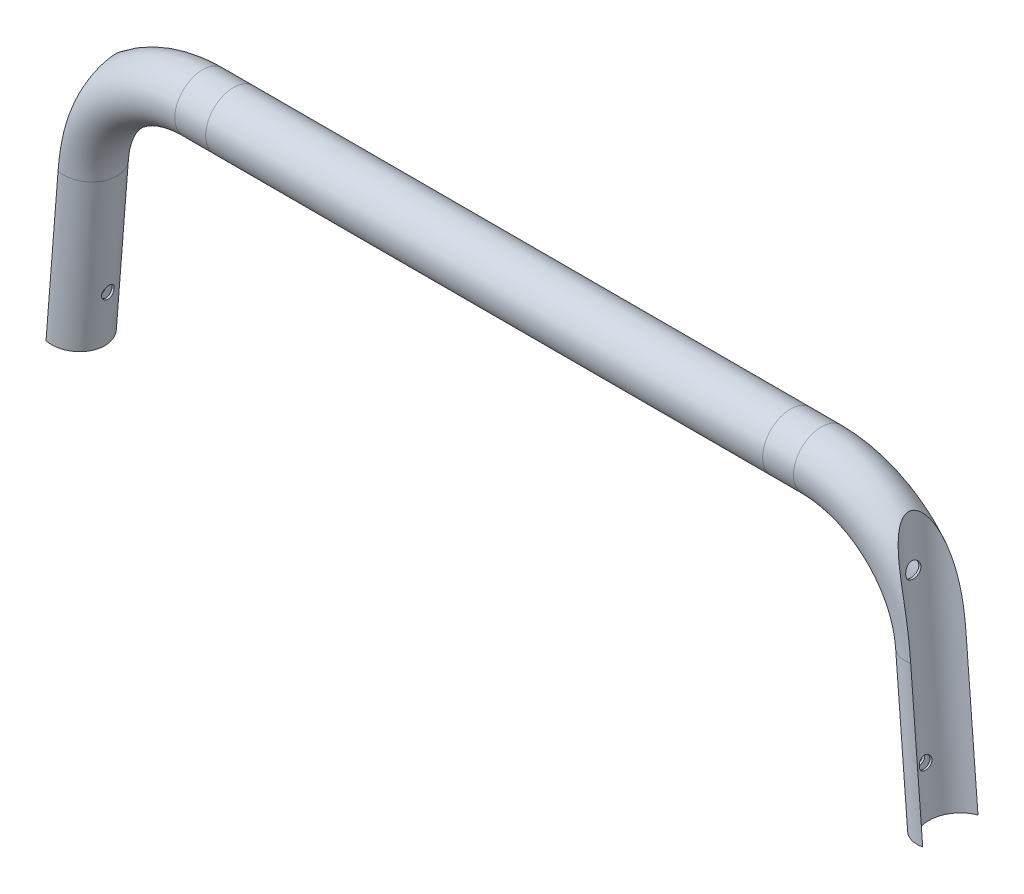
from build123d import *

# Parameters (mm, degrees)
SKETCH2_R               = 11
SKETCH2_R_2             = 10.2
SKETCH3_R               = 11.23581799789534
CUT_EXTRUDE1_DEPTH      = 230.5845222963601
BOSS_EXTRUDE1_REACH     = 223.606
CUT_EXTRUDE2_REACH      = 365.113
CUT_EXTRUDE2_END_RADIUS = 11.00000000000001
SKETCH8_R               = 2.5
CUT_EXTRUDE3_REACH      = 369.953
CUT_EXTRUDE3_END_RADIUS = 12.035817997895382
SKETCH9_R               = 3.0000000000000013


with BuildPart() as part:
    # Sweep1: sweep along a path in Sketch1
    with BuildLine(Plane.XY) as sweep1_path:
        Line((-171.8, -101.9), (-167.04400396794307, -41.46934069224712))
        ThreePointArc((-167.04400396794307, -41.46934069224712), (-152.7287574989347, -11.955487075394196), (-122.18272394995228, 0))
        Line((-122.18272394995228, 0), (-110, 1.01e-15))
        Line((-110, 1.01e-15), (110, 1.01e-15))
        Line((110, 1.01e-15), (122.18272394995228, 0))
        ThreePointArc((122.18272394995228, 0), (152.72875749893473, -11.955487075394181), (167.04400396794307, -41.46934069224712))
        Line((167.04400396794307, -41.46934069224712), (171.8, -101.9))
    # Sketch2 → Sweep1 (sweep)
    with BuildSketch(Plane(origin=(-171.79999999999998, -101.90000000000002, 0), x_dir=(-0.9969173337331282, 0.07845909572784168, 0), z_dir=(-0.07845909572784168, -0.9969173337331282, 0))):
        Circle(SKETCH2_R)
        Circle(SKETCH2_R_2, mode=Mode.SUBTRACT)
    sweep(path=sweep1_path.line)

    # Sketch3 → Cut-Extrude1 (cut, through all)
    with BuildSketch(Plane(origin=(9.02790753667694, -114.71044150027745, 0), x_dir=(0.9969173337331282, 0.07845909572784168, 0), z_dir=(0.07845909572784168, -0.9969173337331282, 0))):
        with Locations((167.27541608068444, 0)):
            Circle(SKETCH3_R)
    cut_extrude1 = extrude(amount=-CUT_EXTRUDE1_DEPTH, mode=Mode.SUBTRACT)

    # Mirror1: Cut-Extrude1 across plane
    add(cut_extrude1.mirror(Plane(origin=(0, 0, 0), x_dir=(0, 0, 1), z_dir=(1, 0, 0))), mode=Mode.SUBTRACT)

    # Sketch6 → Boss-Extrude1 (add, up to next)
    with BuildSketch(Plane(origin=(9.027907536676944, -114.71044150027747, 0), x_dir=(0.9969173337331283, 0.07845909572784171, 0), z_dir=(0.07845909572784171, -0.9969173337331283, 0)), mode=Mode.PRIVATE) as boss_extrude1_sk1:
        with BuildLine():
            ThreePointArc((163.21850968110442, 10.477839307169974), (156.03959808278907, 1.38e-15), (163.21850968110442, -10.477839307169974))
            ThreePointArc((163.21850968110442, -10.477839307169974), (162.0472251297871, -10.405762916447943), (160.89134608152528, -10.203164466198636))
            ThreePointArc((160.89134608152528, -10.203164466198636), (155.23959808278906, 1.216e-14), (160.8913460815253, 10.203164466198638))
            ThreePointArc((160.8913460815253, 10.203164466198638), (162.04722512978714, 10.405762916447944), (163.21850968110442, 10.477839307169974))
        make_face()
    boss_extrude1_tool1 = extrude(boss_extrude1_sk1.sketch, amount=-BOSS_EXTRUDE1_REACH, mode=Mode.PRIVATE) - part.part
    boss_extrude1 = boss_extrude1_tool1.solids().sort_by_distance((170.601798, -101.994301, -10.183076))[0]
    add(boss_extrude1)

    # Mirror2: Boss-Extrude1 across plane
    add(boss_extrude1.mirror(Plane(origin=(0, 0, 0), x_dir=(0, 0, 1), z_dir=(1, 0, 0))))

    # Cut-Extrude2: up to this cylinder (the profile starts inside it)
    cut_extrude2_end = Plane(origin=(170.3012594687168, -82.85669596311118, 0), z_dir=(0.07845909572784143, -0.9969173337331283, 0)) * Cylinder(CUT_EXTRUDE2_END_RADIUS, 753.226, mode=Mode.PRIVATE)
    # Sketch8 → Cut-Extrude2 (cut, up to the surface)
    with BuildSketch(Plane(origin=(171.80000000000013, -101.89999999999986, 0), x_dir=(7.6e-16, 6e-17, -1), z_dir=(0.9969173337331283, 0.0784590957278417, 0)), mode=Mode.PRIVATE) as cut_extrude2_sk1:
        with Locations(Location((0, 19.10218999047264, 0), (0, 0, 90))):
            Circle(SKETCH8_R)
    cut_extrude2_tool1 = extrude(cut_extrude2_sk1.sketch, amount=-CUT_EXTRUDE2_REACH, mode=Mode.PRIVATE) & cut_extrude2_end
    cut_extrude2 = cut_extrude2_tool1.solids().sort_by_distance((170.301259, -82.856696, 0))[0]
    add(cut_extrude2, mode=Mode.SUBTRACT)

    # Mirror3: Cut-Extrude2 across plane
    add(cut_extrude2.mirror(Plane(origin=(0, 0, 0), x_dir=(0, 0, 1), z_dir=(1, 0, 0))), mode=Mode.SUBTRACT)

    # Cut-Extrude3: up to this cylinder (the profile starts inside it)
    cut_extrude3_end = Plane(origin=(169.43215579509527, -20.831707376382617, 0), z_dir=(0.07845909572784171, -0.9969173337331282, 0)) * Cylinder(CUT_EXTRUDE3_END_RADIUS, 764.9776359957907, mode=Mode.PRIVATE)
    # Sketch9 → Cut-Extrude3 (cut, up to the surface)
    with BuildSketch(Plane(origin=(180, 0, 0), x_dir=(0, 0, -1), z_dir=(1, 0, 0)), mode=Mode.PRIVATE) as cut_extrude3_sk1:
        with Locations((0, -20)):
            Circle(SKETCH9_R)
    cut_extrude3_tool1 = extrude(cut_extrude3_sk1.sketch, amount=-CUT_EXTRUDE3_REACH, mode=Mode.PRIVATE) & cut_extrude3_end
    add(cut_extrude3_tool1.solids().sort_by_distance((180, -20, 0))[0], mode=Mode.SUBTRACT)


solid = part.part
